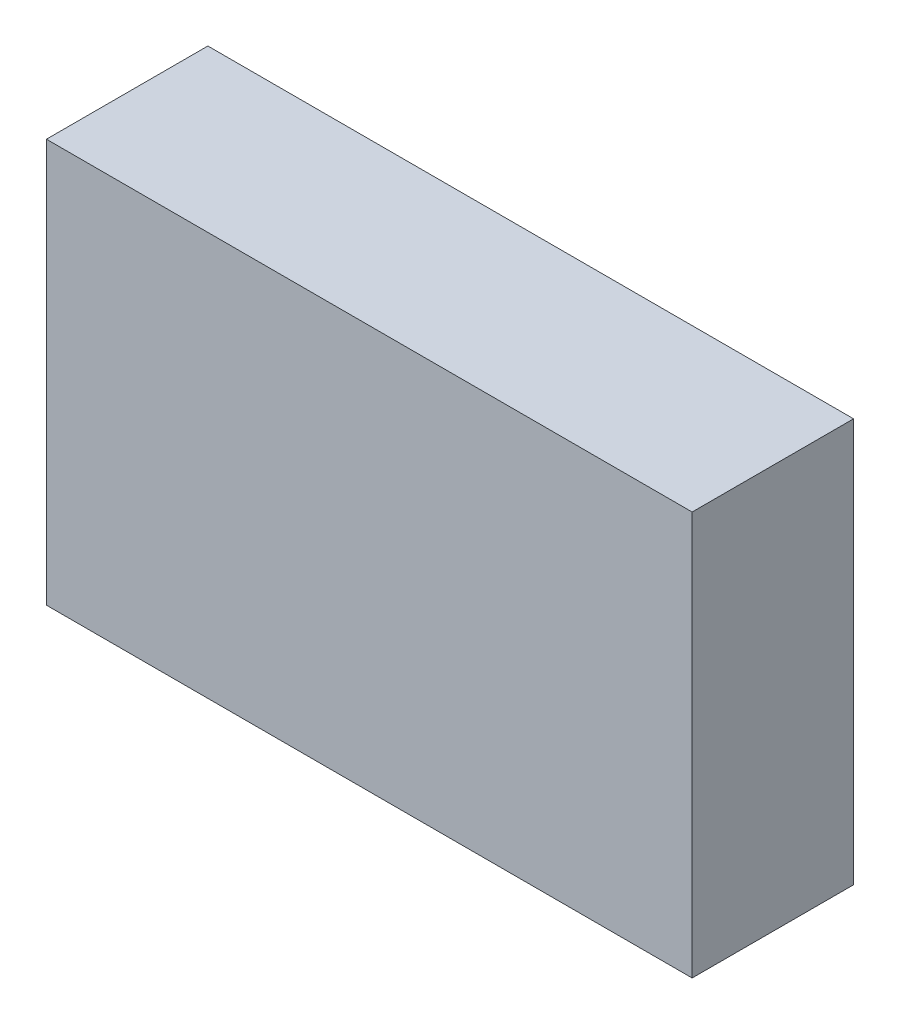
from build123d import *

# Parameters (mm, degrees)
SKETCH1_W           = 40
SKETCH1_H           = 25
BOSS_EXTRUDE1_DEPTH = 10


with BuildPart() as part:
    # Sketch1 → Boss-Extrude1 (new body)
    with BuildSketch(Plane.XY):
        with Locations((0, 12.5)):
            Rectangle(SKETCH1_W, SKETCH1_H)
    extrude(amount=BOSS_EXTRUDE1_DEPTH)


solid = part.part
